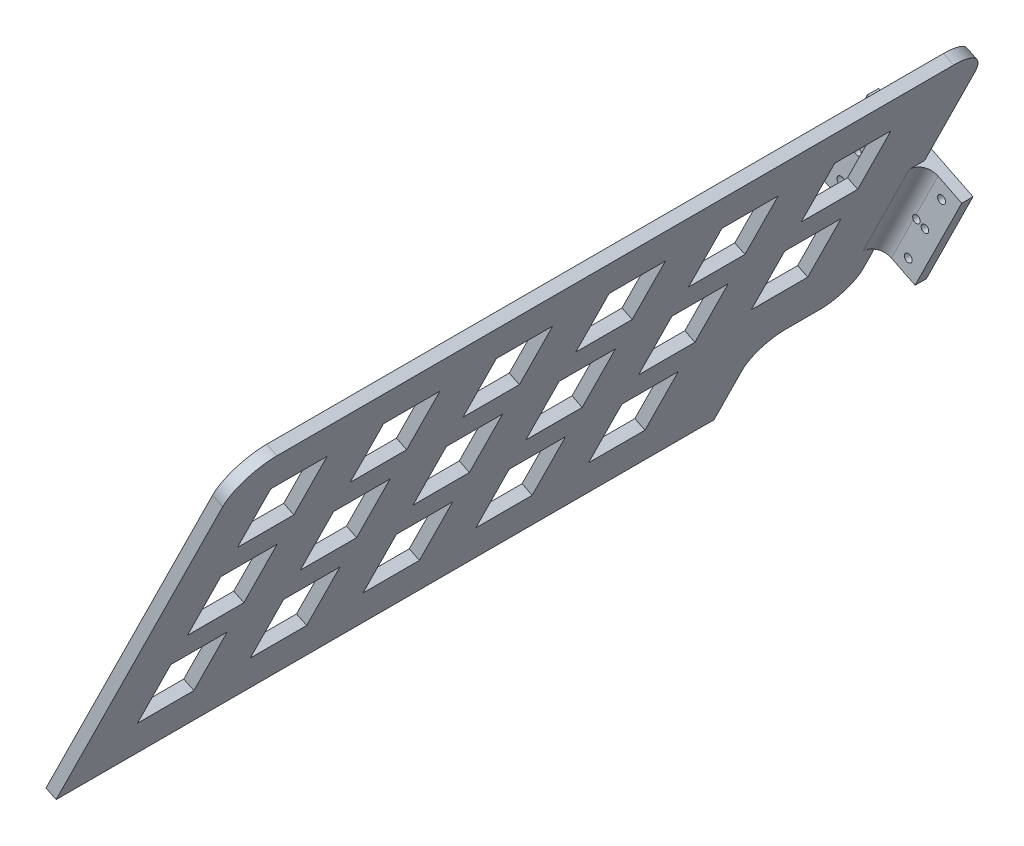
from build123d import *

# Parameters (mm, degrees)
EXTRUDE_1_DEPTH     = 3
EXTRUDE_2_DEPTH     = 200
FILLET_1_R          = 4
SKETCH_4_W          = 25
SKETCH_4_H          = 25
CUT_EXTRUDE_1_DEPTH = 4
FILLET_3_R          = 8
SKETCH_5_W          = 15
SKETCH_5_H          = 20
CUT_EXTRUDE_2_DEPTH = 10
FILLET_4_R          = 10
FILLET_5_R          = 10
SKETCH_7_R          = 1.05
SKETCH_7_R_2        = 1
CUT_EXTRUDE_3_DEPTH = 5


with BuildPart() as part:
    # 草图1 → 凸台-拉伸1 (new body)
    with BuildSketch(Plane.XY):
        Polygon((-68.534318099, 4.283164377), (-80.94435421, -20.816457208), (-55.844732625, -33.22649332), (-43.434696514, -8.126871734), align=None)
    extrude(amount=EXTRUDE_1_DEPTH)

    # 草图2 → 凸台-拉伸2 (add)
    with BuildSketch(Plane.XY.offset(3)):
        Polygon((-87.038364402, -64.656684429), (-38.284651107, 33.948971798), (-35.595405937, 32.619325071), (-84.349119232, -65.986331156), align=None)
    extrude(amount=EXTRUDE_2_DEPTH)

    # 圆角1
    fillet_1_edges = [part.edges().sort_by_distance(p)[0] for p in [
        (-59.529047009, -15.787087985, 3),
        (-62.218292179, -14.457441259, 3),
    ]]
    fillet(fillet_1_edges, radius=FILLET_1_R)

    # 草图4 → 切除-拉伸1 (cut)
    with BuildSketch(Plane(origin=(-44.25211262, 21.879625307, 0), x_dir=(0, 0, 1), z_dir=(-0.8964150566080468, 0.4432155754104229, 0))):
        with Locations((15.5, -84.035984194)):
            Rectangle(SKETCH_4_W, SKETCH_4_H)
    extrude(amount=-CUT_EXTRUDE_1_DEPTH, mode=Mode.SUBTRACT)

    # 圆角3
    fillet_3_edges = [part.edges().sort_by_distance(p)[0] for p in [
        (-74.613352432, -42.911131377, 3),
        (-74.613352432, -42.911131377, 28),
    ]]
    fillet(fillet_3_edges, radius=FILLET_3_R)

    # 草图5 → 切除-拉伸2 (cut)
    with BuildSketch(Plane(origin=(-41.56286745, 20.54997858, 0), x_dir=(0, 0, -1), z_dir=(0.8964150566080469, -0.4432155754104229, 0))):
        with Locations((-60.5, -11.535984194)):
            Rectangle(SKETCH_5_W, SKETCH_5_H)
        with Locations((-30.5, -11.535984194)):
            Rectangle(SKETCH_5_W, SKETCH_5_H)
        with Locations((-90.5, -11.535984194)):
            Rectangle(SKETCH_5_W, SKETCH_5_H)
        with Locations((-120.5, -11.535984194)):
            Rectangle(SKETCH_5_W, SKETCH_5_H)
        with Locations((-150.5, -11.535984194)):
            Rectangle(SKETCH_5_W, SKETCH_5_H)
        with Locations((-180.5, -11.535984194)):
            Rectangle(SKETCH_5_W, SKETCH_5_H)
        with Locations((-60.5, -41.535984194)):
            Rectangle(SKETCH_5_W, SKETCH_5_H)
        with Locations((-90.5, -41.535984194)):
            Rectangle(SKETCH_5_W, SKETCH_5_H)
        with Locations((-120.5, -41.535984194)):
            Rectangle(SKETCH_5_W, SKETCH_5_H)
        with Locations((-150.5, -41.535984194)):
            Rectangle(SKETCH_5_W, SKETCH_5_H)
        with Locations((-180.5, -41.535984194)):
            Rectangle(SKETCH_5_W, SKETCH_5_H)
        with Locations((-60.5, -71.535984194)):
            Rectangle(SKETCH_5_W, SKETCH_5_H)
        with Locations((-90.5, -71.535984194)):
            Rectangle(SKETCH_5_W, SKETCH_5_H)
        with Locations((-120.5, -71.535984194)):
            Rectangle(SKETCH_5_W, SKETCH_5_H)
        with Locations((-150.5, -71.535984194)):
            Rectangle(SKETCH_5_W, SKETCH_5_H)
        with Locations((-180.5, -71.535984194)):
            Rectangle(SKETCH_5_W, SKETCH_5_H)
        with Locations((-30.5, -41.535984194)):
            Rectangle(SKETCH_5_W, SKETCH_5_H)
    extrude(amount=-CUT_EXTRUDE_2_DEPTH, mode=Mode.SUBTRACT)

    # 圆角4
    fillet_4_edges = [part.edges().sort_by_distance(p)[0] for p in [
        (-36.940028522, 33.284148434, 203),
    ]]
    fillet(fillet_4_edges, radius=FILLET_4_R)

    # 圆角5
    fillet_5_edges = [part.edges().sort_by_distance(p)[0] for p in [
        (-36.940028522, 33.284148434, 3),
    ]]
    fillet(fillet_5_edges, radius=FILLET_5_R)

    # 草图7 → 切除-拉伸3 (cut)
    with BuildSketch(Plane(origin=(0, 0, 0), x_dir=(-1, 0, 0), z_dir=(0, 0, -1))):
        with Locations((48.793219042, -9.939669659)):
            Circle(SKETCH_7_R)
        with Locations((66.721520174, -1.075358151)):
            Circle(SKETCH_7_R)
        with Locations((71.153675928, -10.039508717)):
            Circle(SKETCH_7_R_2)
        with Locations((68.912638286, -11.147547656)):
            Circle(SKETCH_7_R_2)
        with Locations((75.585831682, -19.003659283)):
            Circle(SKETCH_7_R)
        with Locations((57.65753055, -27.867970791)):
            Circle(SKETCH_7_R)
        with Locations((53.225374796, -18.903820225)):
            Circle(SKETCH_7_R_2)
        with Locations((55.466412437, -17.795781287)):
            Circle(SKETCH_7_R_2)
    extrude(amount=-CUT_EXTRUDE_3_DEPTH, mode=Mode.SUBTRACT)


solid = part.part
